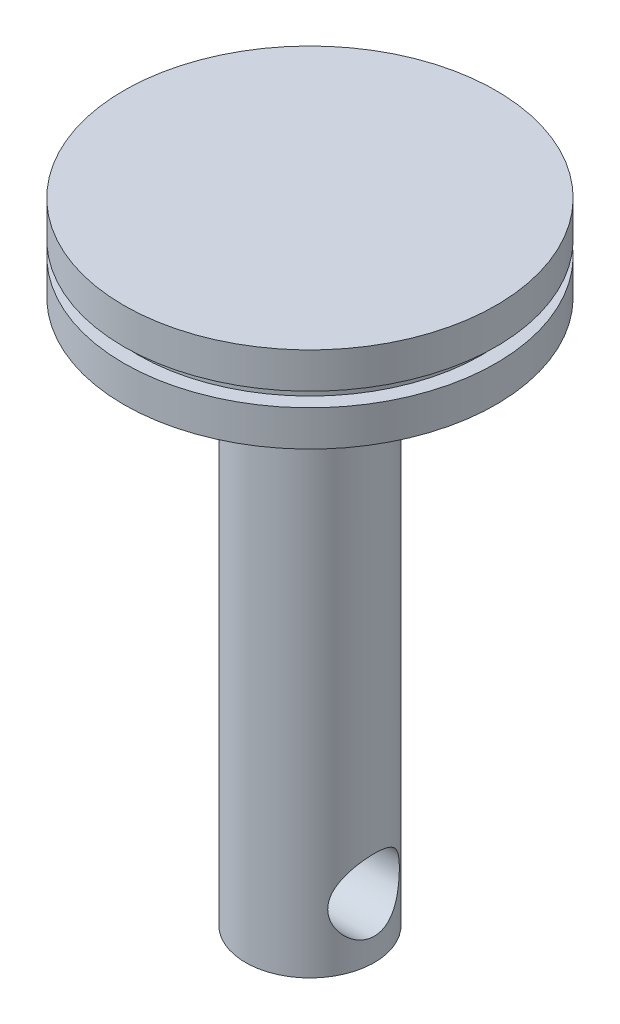
from build123d import *

# Parameters (mm, degrees)
SKETCH2_R                = 4.5
BOSS_EXTRUDE1_DEPTH      = 30
BOSS_EXTRUDE2_DEPTH      = 1
BOSS_EXTRUDE2_DEPTH_BACK = 1
CUT_EXTRUDE3_DEPTH       = 48.765956346
SKETCH6_R                = 4.5
BOSS_EXTRUDE3_DEPTH      = 8
CUT_EXTRUDE2_DEPTH       = 8
CUT_EXTRUDE2_DEPTH_BACK  = 47.071926172
SKETCH4_R                = 2.5
CUT_EXTRUDE5_START       = -8
SKETCH7_R                = 6.95034237
SKETCH7_R_2              = 4.5
CUT_EXTRUDE5_DEPTH       = 8


with BuildPart() as part:
    # Sketch1 → Revolve1 (revolve)
    with BuildSketch(Plane.XY):
        Polygon((0, 2.075992783), (13, 2.075992783), (13, -0.424007217), (12, -0.424007217), (12, -1.424007217), (13, -1.424007217), (13, -3.924007217), (0, -3.924007217), align=None)
    revolve(axis=Axis((0, 49.311920993, 0), (0, -1, 0)))

    # Sketch2 → Boss-Extrude1 (add)
    with BuildSketch(Plane.XZ.offset(3.924007217)):
        Circle(SKETCH2_R)
    extrude(amount=BOSS_EXTRUDE1_DEPTH)

    # Sketch3 → Boss-Extrude2 (add, two sides: drawn at the far end of the back side and taken through both)
    with BuildSketch(Plane(origin=(0, 0, 0), x_dir=(0, 0, -1), z_dir=(1, 0, 0)).offset(-BOSS_EXTRUDE2_DEPTH_BACK)):
        with BuildLine():
            Line((0, -33.924007217), (-4.5, -33.924007217))
            ThreePointArc((-4.5, -33.924007217), (-2.081257447, -43.403287407), (5.954829972, -37.824007217))
            ThreePointArc((5.954829972, -37.824007217), (5.57928019, -35.74274977), (4.5, -33.924007217))
            Line((4.5, -33.924007217), (0, -33.924007217))
        make_face()
    extrude(amount=BOSS_EXTRUDE2_DEPTH + BOSS_EXTRUDE2_DEPTH_BACK)

    # Sketch5 → Cut-Extrude3 (cut, through all)
    with BuildSketch(Plane(origin=(1, 0, 0), x_dir=(0, 0, -1), z_dir=(1, 0, 0))):
        with BuildLine():
            Line((5.205457264, -40.715929532), (-5.205457264, -40.715929532))
            ThreePointArc((-5.205457264, -40.715929532), (0, -43.77883719), (5.205457264, -40.715929532))
        make_face()
    extrude(amount=-CUT_EXTRUDE3_DEPTH, mode=Mode.SUBTRACT)

    # Sketch6 → Boss-Extrude3 (add)
    with BuildSketch(Plane.XZ.offset(33.924007217)):
        Circle(SKETCH6_R)
    extrude(amount=BOSS_EXTRUDE3_DEPTH)

    # Sketch4 → Cut-Extrude2 (cut, two sides: drawn at the far end of the back side and taken through both)
    with BuildSketch(Plane.ZY.offset(1).offset(-CUT_EXTRUDE2_DEPTH_BACK)):
        with Locations((0, -37.824007217)):
            Circle(SKETCH4_R)
    extrude(amount=CUT_EXTRUDE2_DEPTH + CUT_EXTRUDE2_DEPTH_BACK, mode=Mode.SUBTRACT)

    # Sketch7 → Cut-Extrude5 (cut)
    with BuildSketch(Plane.XZ.offset(41.924007217).offset(CUT_EXTRUDE5_START)):
        Circle(SKETCH7_R)
        Circle(SKETCH7_R_2, mode=Mode.SUBTRACT)
    extrude(amount=CUT_EXTRUDE5_DEPTH, mode=Mode.SUBTRACT)


solid = part.part
